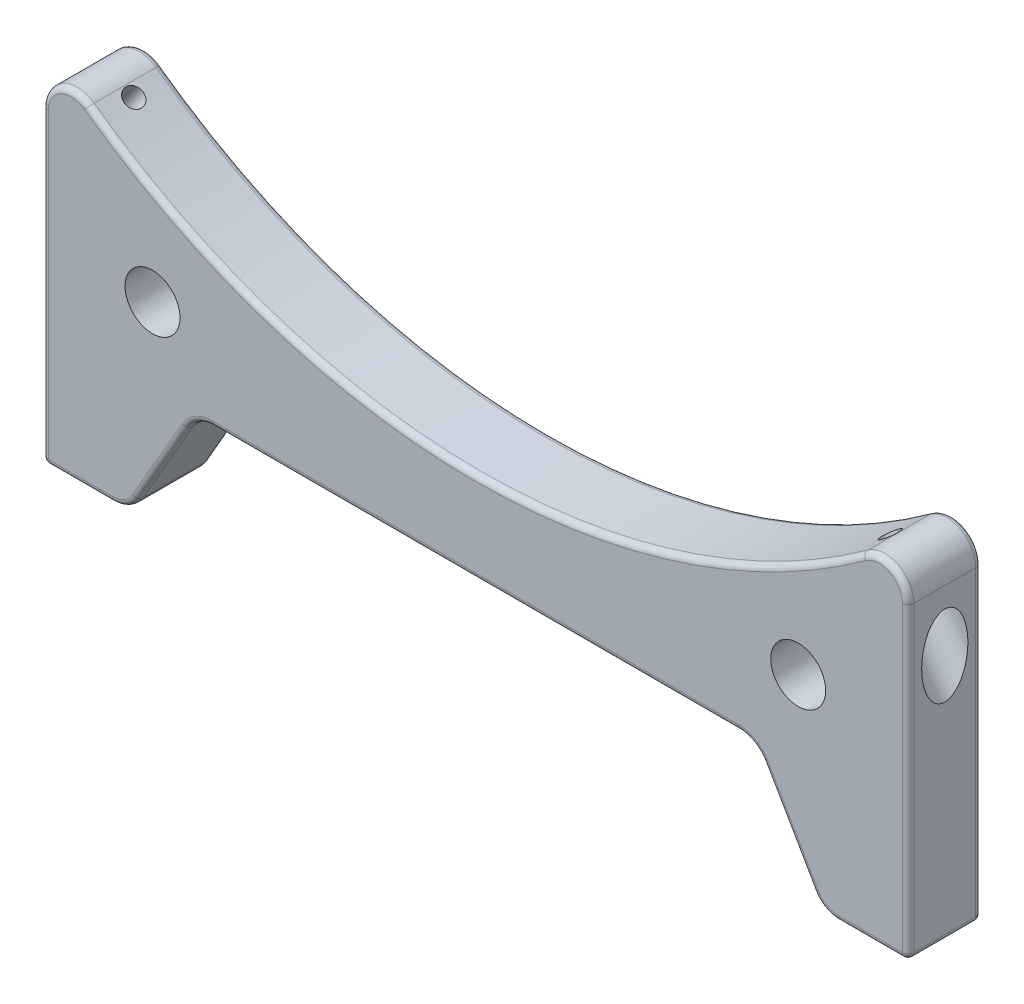
from build123d import *

# Parameters (mm, degrees)
BOSS_EXTRUDE1_DEPTH = 12.7
SKETCH14_R          = 4
CUT_EXTRUDE1_DEPTH  = 12.7
SKETCH14_3_R        = 1.63195
CUT_EXTRUDE2_DEPTH  = 158.035218157
CUT_EXTRUDE3_DEPTH  = 169.185284783
FILLET1_R           = 5
FILLET2_R           = 1
SKETCH16_R          = 4.7625
CUT_EXTRUDE4_DEPTH  = 169.185284738


with BuildPart() as part:
    # Sketch1 → Boss-Extrude1 (new body)
    with BuildSketch(Plane.XY):
        with BuildLine():
            ThreePointArc((75, -86.252478225), (0, -114.3), (-75, -86.252478225))
            Line((-75, -86.252478225), (-75, -150))
            Line((-75, -150), (75, -150))
            Line((75, -150), (75, -86.252478225))
        make_face()
    extrude(amount=BOSS_EXTRUDE1_DEPTH)

    # Sketch14 → Cut-Extrude1 (cut, symmetric)
    with BuildSketch(Plane(origin=(-75.884162529, -108.373815459, 0), x_dir=(-0.8191520442889954, 0.5735764363510409, 0), z_dir=(0.5735764363510409, 0.8191520442889954, 0))):
        with Locations((0, 6.35)):
            Circle(SKETCH14_R)
    cut_extrude1 = extrude(amount=CUT_EXTRUDE1_DEPTH, both=True, mode=Mode.SUBTRACT)

    # Sketch14<3> → Cut-Extrude2 (cut, through all)
    with BuildSketch(Plane(origin=(-75.884162529, -108.373815459, 0), x_dir=(-0.8191520442889954, 0.5735764363510409, 0), z_dir=(0.5735764363510409, 0.8191520442889954, 0))):
        with Locations((0, 6.35)):
            Circle(SKETCH14_3_R)
    cut_extrude2 = extrude(amount=CUT_EXTRUDE2_DEPTH, mode=Mode.SUBTRACT)

    # Mirror1: Cut-Extrude1, Cut-Extrude2 across plane
    add(cut_extrude1.mirror(Plane(origin=(0, 0, 0), x_dir=(0, 0, 1), z_dir=(1, 0, 0))), mode=Mode.SUBTRACT)
    add(cut_extrude2.mirror(Plane(origin=(0, 0, 0), x_dir=(0, 0, 1), z_dir=(1, 0, 0))), mode=Mode.SUBTRACT)

    # Sketch15 → Cut-Extrude3 (cut, through all)
    with BuildSketch(Plane.XY.offset(12.7)):
        Polygon((48.452994616, -130), (-48.452994616, -130), (-60, -150), (60, -150), align=None)
    extrude(amount=-CUT_EXTRUDE3_DEPTH, mode=Mode.SUBTRACT)

    # Fillet1
    fillet1_edges = [part.edges().sort_by_distance(p)[0] for p in [
        (75, -86.252478225, 6.35),
        (60, -150, 6.35),
        (48.452994616, -130, 6.35),
        (-48.452994616, -130, 6.35),
        (-60, -150, 6.35),
        (-75, -86.252478225, 6.35),
    ]]
    fillet(fillet1_edges, radius=FILLET1_R)

    # Fillet2
    fillet2_edges = [part.edges().sort_by_distance(p)[0] for p in [
        (60.386751346, -149.330127019, 0),
        (54.226497308, -140, 0),
        (60.386751346, -149.330127019, 12.7),
        (68.943375673, -150, 0),
        (48.06624327, -130.669872981, 0),
        (54.226497308, -140, 12.7),
        (75, -150, 6.35),
        (68.943375673, -150, 12.7),
        (75, -123.302406772, 0),
        (0, -130, 0),
        (48.06624327, -130.669872981, 12.7),
        (75, -123.302406772, 12.7),
        (72.272784424, -92.151224996, 0),
        (-48.06624327, -130.669872981, 0),
        (0, -130, 12.7),
        (72.272784424, -92.151224996, 12.7),
        (0, -114.3, 0),
        (-54.226497308, -140, 0),
        (-48.06624327, -130.669872981, 12.7),
        (0, -114.3, 12.7),
        (-72.272784424, -92.151224996, 0),
        (-60.386751346, -149.330127019, 0),
        (-54.226497308, -140, 12.7),
        (-72.272784424, -92.151224996, 12.7),
        (-75, -123.302406772, 0),
        (-68.943375673, -150, 0),
        (-60.386751346, -149.330127019, 12.7),
        (-75, -123.302406772, 12.7),
        (-75, -150, 6.35),
        (-68.943375673, -150, 12.7),
    ]]
    fillet(fillet2_edges, radius=FILLET2_R)

    # Sketch16 → Cut-Extrude4 (cut, through all)
    with BuildSketch(Plane.XY.offset(12.7)):
        with Locations((-55.95, -116.345)):
            Circle(SKETCH16_R)
        with Locations((55.95, -116.345)):
            Circle(SKETCH16_R)
    extrude(amount=-CUT_EXTRUDE4_DEPTH, mode=Mode.SUBTRACT)


solid = part.part
